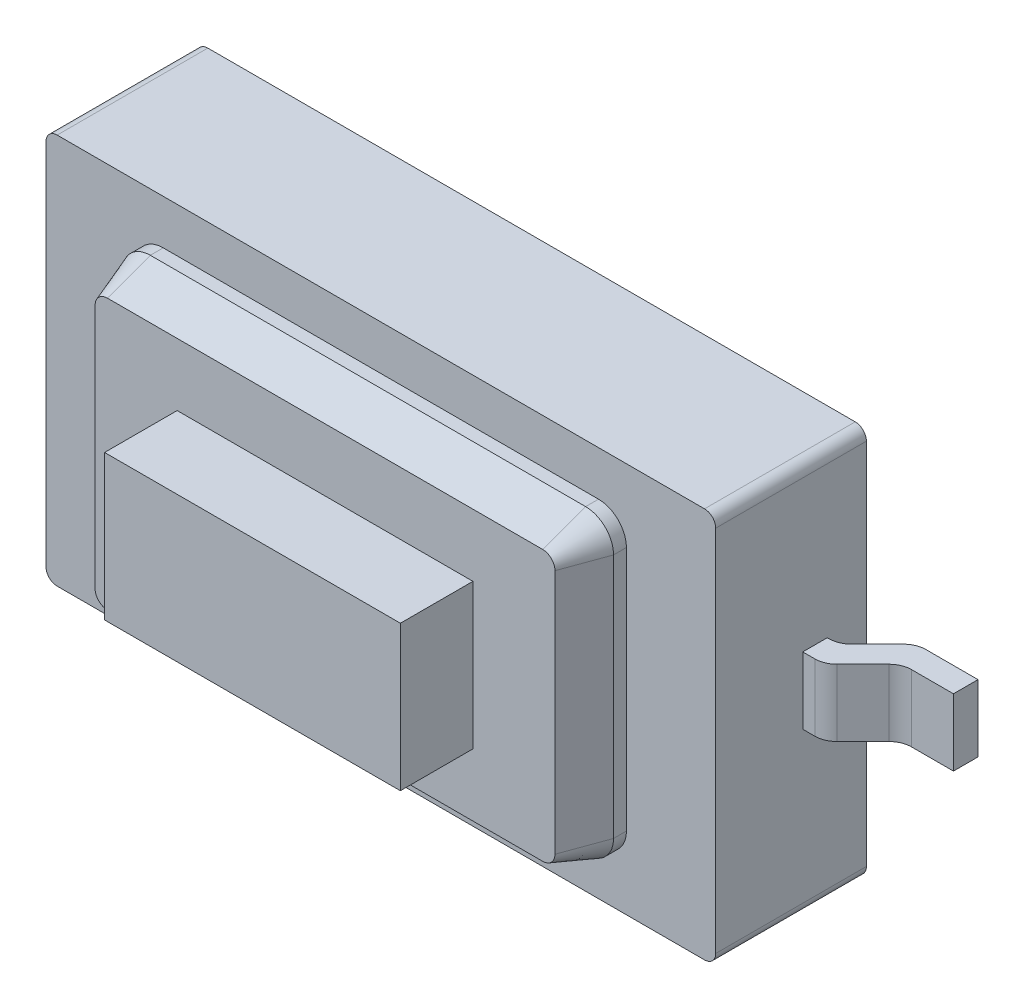
from build123d import *

# Parameters (mm, degrees)
BOSS_EXTRUDE1_DEPTH = 1.35
BOSS_EXTRUDE2_DEPTH = 1.85
SKETCH1_4_W         = 2.65
SKETCH1_4_H         = 1.3
BOSS_EXTRUDE3_DEPTH = 2.5
CHAMFER1_SIZE       = 0.14
CHAMFER1_SIZE2      = 0.384646839
BOSS_EXTRUDE4_DEPTH = 0.3


with BuildPart() as part:
    # Sketch1 → Boss-Extrude1 (new body)
    with BuildSketch(Plane.XY):
        with BuildLine():
            Line((-2.9, 1.75), (2.9, 1.75))
            ThreePointArc((2.9, 1.75), (2.970710678, 1.720710678), (3, 1.65))
            Line((3, 1.65), (3, -1.65))
            ThreePointArc((3, -1.65), (2.970710678, -1.720710678), (2.9, -1.75))
            Line((2.9, -1.75), (-2.9, -1.75))
            ThreePointArc((-2.9, -1.75), (-2.970710678, -1.720710678), (-3, -1.65))
            Line((-3, -1.65), (-3, 1.65))
            ThreePointArc((-3, 1.65), (-2.970710678, 1.720710678), (-2.9, 1.75))
        make_face()
    extrude(amount=BOSS_EXTRUDE1_DEPTH)

    # Sketch1<3> → Boss-Extrude2 (add)
    with BuildSketch(Plane.XY):
        with BuildLine():
            Line((-1.95, 1.35), (1.95, 1.35))
            ThreePointArc((1.95, 1.35), (2.126776695, 1.276776695), (2.2, 1.1))
            Line((2.2, 1.1), (2.2, -1.1))
            ThreePointArc((2.2, -1.1), (2.126776695, -1.276776695), (1.95, -1.35))
            Line((1.95, -1.35), (-1.95, -1.35))
            ThreePointArc((-1.95, -1.35), (-2.126776695, -1.276776695), (-2.2, -1.1))
            Line((-2.2, -1.1), (-2.2, 1.1))
            ThreePointArc((-2.2, 1.1), (-2.126776695, 1.276776695), (-1.95, 1.35))
        make_face()
    extrude(amount=BOSS_EXTRUDE2_DEPTH)

    # Sketch1<4> → Boss-Extrude3 (add)
    with BuildSketch(Plane.XY):
        Rectangle(SKETCH1_4_W, SKETCH1_4_H)
    extrude(amount=BOSS_EXTRUDE3_DEPTH)

    # Chamfer1
    chamfer1_edges = [part.edges().sort_by_distance(p)[0] for p in [
        (0, -1.35, 1.85),
        (-2.126776695, -1.276776695, 1.85),
        (-2.2, 0, 1.85),
        (-2.126776695, 1.276776695, 1.85),
        (2.2, 0, 1.85),
        (2.126776695, 1.276776695, 1.85),
        (0, 1.35, 1.85),
    ]]
    chamfer1_side = [part.faces().sort_by_distance(p)[0] for p in [
        (0, 1.298376362, 1.85),
    ]]
    chamfer(chamfer1_edges, length=CHAMFER1_SIZE, length2=CHAMFER1_SIZE2, reference=chamfer1_side[0])

    # Sketch2 → Boss-Extrude4 (add, symmetric)
    with BuildSketch(Plane(origin=(0, 0, 0), x_dir=(1, 0, 0), z_dir=(0, 1, 0))):
        with BuildLine():
            Line((3, -0.35), (3.017157288, -0.35))
            ThreePointArc((3.017157288, -0.35), (3.093693974, -0.334775907), (3.158578644, -0.291421356))
            Line((3.158578644, -0.291421356), (3.391421356, -0.058578644))
            ThreePointArc((3.391421356, -0.058578644), (3.456306026, -0.015224093), (3.532842712, 0))
            Line((3.532842712, 0), (4, 0))
            Line((4, 0), (4, -0.22))
            Line((4, -0.22), (3.623969696, -0.22))
            ThreePointArc((3.623969696, -0.22), (3.54743301, -0.235224093), (3.48254834, -0.278578644))
            Line((3.48254834, -0.278578644), (3.249705627, -0.511421356))
            ThreePointArc((3.249705627, -0.511421356), (3.184820958, -0.554775907), (3.108284271, -0.57))
            Line((3.108284271, -0.57), (3, -0.57))
            Line((3, -0.57), (3, -0.35))
        make_face()
    boss_extrude4 = extrude(amount=BOSS_EXTRUDE4_DEPTH, both=True)

    # Mirror1: Boss-Extrude4 across plane
    add(boss_extrude4.mirror(Plane(origin=(0, 0, 0), x_dir=(0, 0, 1), z_dir=(1, 0, 0))))


solid = part.part
